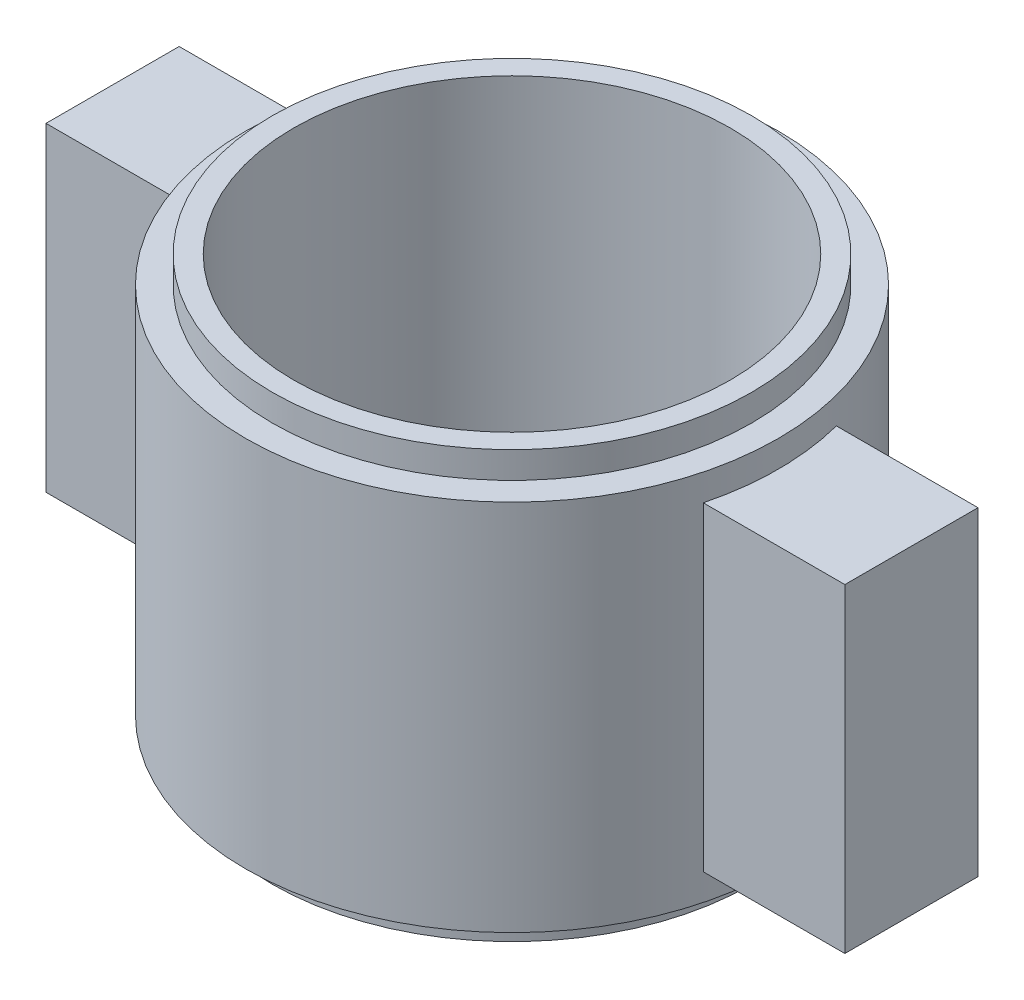
from build123d import *

# Parameters (mm, degrees)
SKETCH_3_W              = 7
SKETCH_3_H              = 12
CONTINUOUS_TONGUE_DEPTH = 5
SKETCH_4_W              = 7
SKETCH_4_H              = 12
EXTRUDE_2_DEPTH         = 5
SKETCH_5_R              = 8.2
D16_CLEARANCE_DEPTH     = 25.103941586


with BuildPart() as part:
    # 草图1 → Round_nut (revolve)
    with BuildSketch(Plane.XY, mode=Mode.PRIVATE) as round_nut_sk:
        Polygon((4.2, 0), (9, 0), (9, 1), (10, 1), (10, 15), (9, 15), (9, 16), (4.2, 16), align=None)
    revolve(round_nut_sk.sketch.rotate(Axis((0, 0, 0), (0, 1, 0)), 90), axis=Axis((0, 0, 0), (0, 1, 0)))

    # 草图3 → Continuous_tongue (add)
    with BuildSketch(Plane.XY.offset(-2.5)):
        with Locations((-11.5, 8)):
            Rectangle(SKETCH_3_W, SKETCH_3_H)
    extrude(amount=CONTINUOUS_TONGUE_DEPTH)

    # 草图4 → 凸台-拉伸2 (add)
    with BuildSketch(Plane.XY.offset(-2.5)):
        with Locations((11.5, 8)):
            Rectangle(SKETCH_4_W, SKETCH_4_H)
    extrude(amount=EXTRUDE_2_DEPTH)

    # 草图5 → D16_clearance (cut, through all)
    with BuildSketch(Plane(origin=(0, 16, 0), x_dir=(1, 0, 0), z_dir=(0, 1, 0))):
        with Locations(Location((0, 0, 0), (0, 0, 270))):
            Circle(SKETCH_5_R)
    extrude(amount=-D16_CLEARANCE_DEPTH, mode=Mode.SUBTRACT)


solid = part.part
